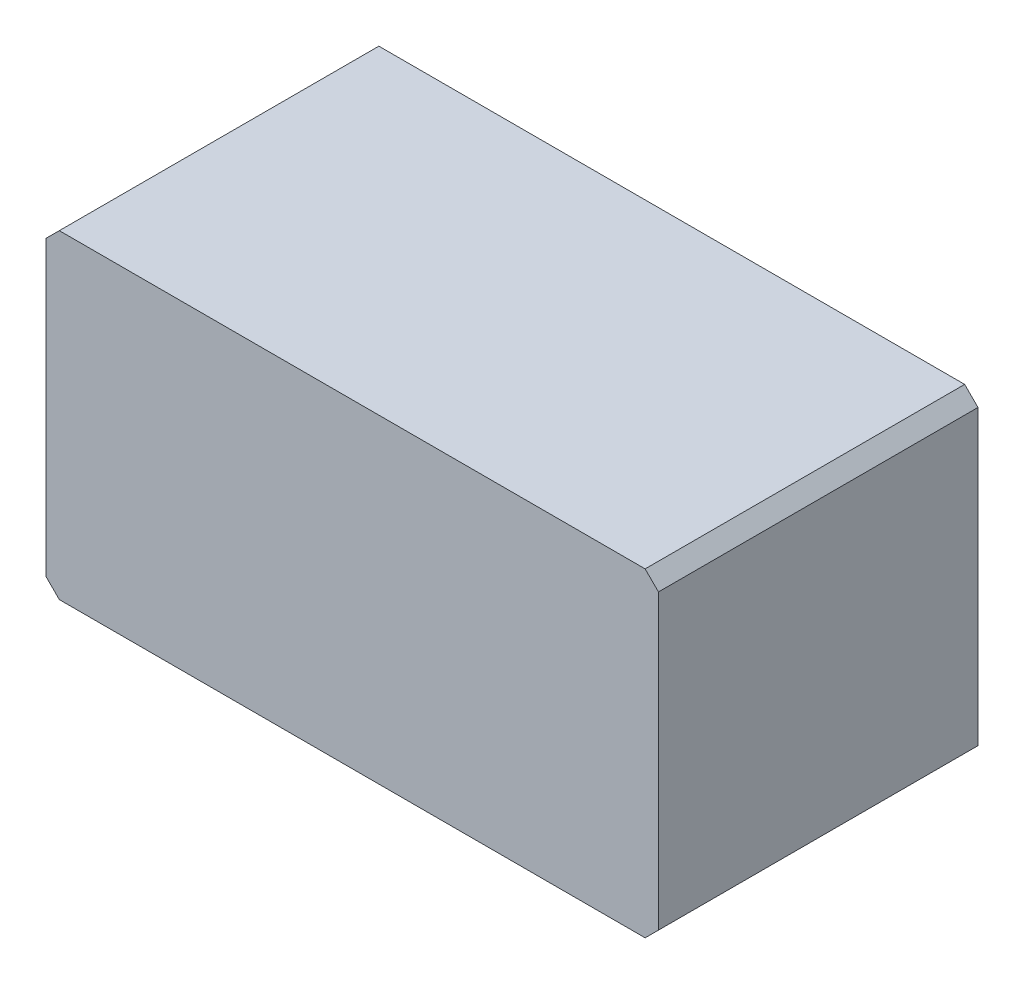
from build123d import *

# Parameters (mm, degrees)
COMPONENT_OUTLINE_DEPTH = 0.6


with BuildPart() as part:
    # 草图1 → Component_Outline (new body)
    with BuildSketch(Plane.XY):
        Polygon((-0.575, 0.275), (-0.55, 0.3), (0.55, 0.3), (0.575, 0.275), (0.575, -0.275), (0.55, -0.3), (-0.55, -0.3), (-0.575, -0.275), align=None)
    extrude(amount=COMPONENT_OUTLINE_DEPTH)


solid = part.part
